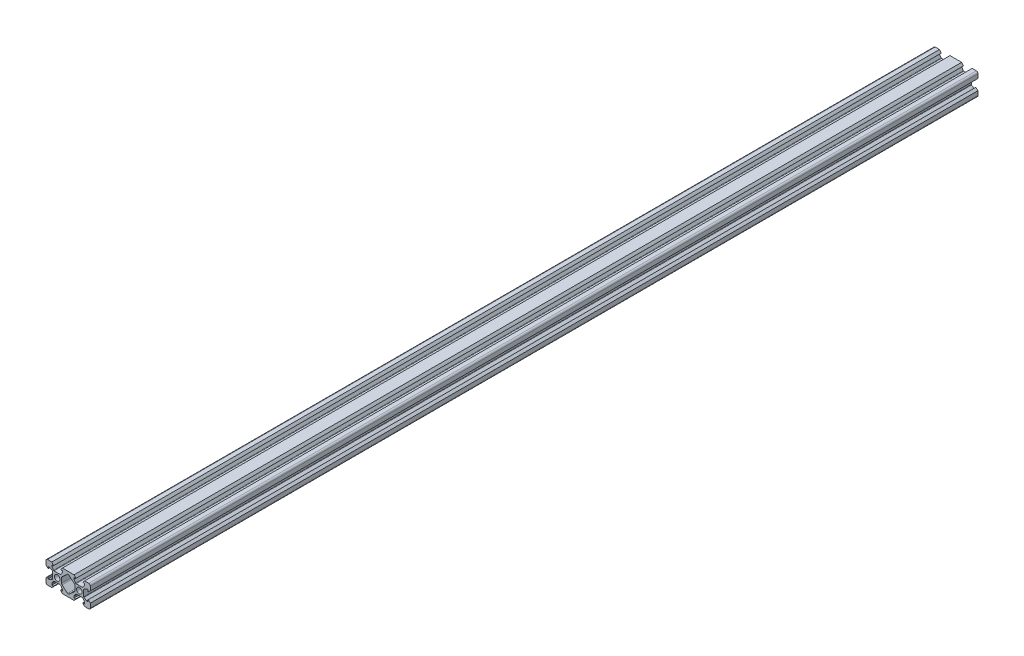
from build123d import *

# Parameters (mm, degrees)
SKETCH_1_R      = 2.5
EXTRUDE_1_DEPTH = 800


with BuildPart() as part:
    # Эскиз1 → Бобышка-Вытянуть1 (new body)
    with BuildSketch(Plane.XY):
        with BuildLine():
            Line((-18.5, 14.076873633), (-14.75, 14.076873633))
            Line((-14.75, 14.076873633), (-13.1, 12.076873633))
            Line((-13.1, 12.076873633), (-14.65, 12.076873633))
            ThreePointArc((-14.65, 12.076873633), (-14.720710678, 12.047584311), (-14.75, 11.976873633))
            Line((-14.75, 11.976873633), (-14.75, 10.726998833))
            ThreePointArc((-14.75, 10.726998833), (-14.728880127, 10.583214884), (-14.667304703, 10.451577729))
            Line((-14.667304703, 10.451577729), (-13.248222071, 8.301452529))
            ThreePointArc((-13.248222071, 8.301452529), (-13.067866147, 8.136583642), (-12.830917368, 8.076873633))
            Line((-12.830917368, 8.076873633), (-7.169082632, 8.076873633))
            ThreePointArc((-7.169082632, 8.076873633), (-6.932133853, 8.136583642), (-6.751777929, 8.301452529))
            Line((-6.751777929, 8.301452529), (-5.332695297, 10.451577729))
            ThreePointArc((-5.332695297, 10.451577729), (-5.271119873, 10.583214884), (-5.25, 10.726998833))
            Line((-5.25, 10.726998833), (-5.25, 11.976873633))
            ThreePointArc((-5.25, 11.976873633), (-5.279289322, 12.047584311), (-5.35, 12.076873633))
            Line((-5.35, 12.076873633), (-6.9, 12.076873633))
            Line((-6.9, 12.076873633), (-5.25, 14.076873633))
            Line((-5.25, 14.076873633), (5.25, 14.076873633))
            Line((5.25, 14.076873633), (6.9, 12.076873633))
            Line((6.9, 12.076873633), (5.35, 12.076873633))
            ThreePointArc((5.35, 12.076873633), (5.279289322, 12.047584311), (5.25, 11.976873633))
            Line((5.25, 11.976873633), (5.25, 10.726998833))
            ThreePointArc((5.25, 10.726998833), (5.271119873, 10.583214884), (5.332695297, 10.451577729))
            Line((5.332695297, 10.451577729), (6.751777929, 8.301452529))
            ThreePointArc((6.751777929, 8.301452529), (6.932133853, 8.136583642), (7.169082632, 8.076873633))
            Line((7.169082632, 8.076873633), (12.830917368, 8.076873633))
            ThreePointArc((12.830917368, 8.076873633), (13.067866147, 8.136583642), (13.248222071, 8.301452529))
            Line((13.248222071, 8.301452529), (14.667304703, 10.451577729))
            ThreePointArc((14.667304703, 10.451577729), (14.728880127, 10.583214884), (14.75, 10.726998833))
            Line((14.75, 10.726998833), (14.75, 11.976873633))
            ThreePointArc((14.75, 11.976873633), (14.720710678, 12.047584311), (14.65, 12.076873633))
            Line((14.65, 12.076873633), (13.1, 12.076873633))
            Line((13.1, 12.076873633), (14.75, 14.076873633))
            Line((14.75, 14.076873633), (18.5, 14.076873633))
            ThreePointArc((18.5, 14.076873633), (19.560660172, 13.637533805), (20, 12.576873633))
            Line((20, 12.576873633), (20, 8.826873633))
            Line((20, 8.826873633), (18, 7.176873633))
            Line((18, 7.176873633), (18, 8.726873633))
            ThreePointArc((18, 8.726873633), (17.970710678, 8.797584311), (17.9, 8.826873633))
            Line((17.9, 8.826873633), (16.6501252, 8.826873633))
            ThreePointArc((16.6501252, 8.826873633), (16.50634125, 8.80575376), (16.374704096, 8.744178337))
            Line((16.374704096, 8.744178337), (14.224578896, 7.325095704))
            ThreePointArc((14.224578896, 7.325095704), (14.059710009, 7.14473978), (14, 6.907791001))
            Line((14, 6.907791001), (14, 1.245956265))
            ThreePointArc((14, 1.245956265), (14.059710009, 1.009007486), (14.224578896, 0.828651562))
            Line((14.224578896, 0.828651562), (16.374704096, -0.59043107))
            ThreePointArc((16.374704096, -0.59043107), (16.50634125, -0.652006494), (16.6501252, -0.673126367))
            Line((16.6501252, -0.673126367), (17.9, -0.673126367))
            ThreePointArc((17.9, -0.673126367), (17.970710678, -0.643837045), (18, -0.573126367))
            Line((18, -0.573126367), (18, 0.976873633))
            Line((18, 0.976873633), (20, -0.673126367))
            Line((20, -0.673126367), (20, -4.423126367))
            ThreePointArc((20, -4.423126367), (19.560660172, -5.483786539), (18.5, -5.923126367))
            Line((18.5, -5.923126367), (14.75, -5.923126367))
            Line((14.75, -5.923126367), (13.1, -3.923126367))
            Line((13.1, -3.923126367), (14.65, -3.923126367))
            ThreePointArc((14.65, -3.923126367), (14.720710678, -3.893837045), (14.75, -3.823126367))
            Line((14.75, -3.823126367), (14.75, -2.573251567))
            ThreePointArc((14.75, -2.573251567), (14.728880127, -2.429467617), (14.667304703, -2.297830463))
            Line((14.667304703, -2.297830463), (13.248222071, -0.147705263))
            ThreePointArc((13.248222071, -0.147705263), (13.067866147, 0.017163624), (12.830917368, 0.076873633))
            Line((12.830917368, 0.076873633), (7.169082632, 0.076873633))
            ThreePointArc((7.169082632, 0.076873633), (6.932133853, 0.017163624), (6.751777929, -0.147705263))
            Line((6.751777929, -0.147705263), (5.332695297, -2.297830463))
            ThreePointArc((5.332695297, -2.297830463), (5.271119873, -2.429467617), (5.25, -2.573251567))
            Line((5.25, -2.573251567), (5.25, -3.823126367))
            ThreePointArc((5.25, -3.823126367), (5.279289322, -3.893837045), (5.35, -3.923126367))
            Line((5.35, -3.923126367), (6.9, -3.923126367))
            Line((6.9, -3.923126367), (5.25, -5.923126367))
            Line((5.25, -5.923126367), (-5.25, -5.923126367))
            Line((-5.25, -5.923126367), (-6.9, -3.923126367))
            Line((-6.9, -3.923126367), (-5.35, -3.923126367))
            ThreePointArc((-5.35, -3.923126367), (-5.279289322, -3.893837045), (-5.25, -3.823126367))
            Line((-5.25, -3.823126367), (-5.25, -2.573251567))
            ThreePointArc((-5.25, -2.573251567), (-5.271119873, -2.429467617), (-5.332695297, -2.297830463))
            Line((-5.332695297, -2.297830463), (-6.751777929, -0.147705263))
            ThreePointArc((-6.751777929, -0.147705263), (-6.932133853, 0.017163624), (-7.169082632, 0.076873633))
            Line((-7.169082632, 0.076873633), (-12.830917368, 0.076873633))
            ThreePointArc((-12.830917368, 0.076873633), (-13.067866147, 0.017163624), (-13.248222071, -0.147705263))
            Line((-13.248222071, -0.147705263), (-14.667304703, -2.297830463))
            ThreePointArc((-14.667304703, -2.297830463), (-14.728880127, -2.429467617), (-14.75, -2.573251567))
            Line((-14.75, -2.573251567), (-14.75, -3.823126367))
            ThreePointArc((-14.75, -3.823126367), (-14.720710678, -3.893837045), (-14.65, -3.923126367))
            Line((-14.65, -3.923126367), (-13.1, -3.923126367))
            Line((-13.1, -3.923126367), (-14.75, -5.923126367))
            Line((-14.75, -5.923126367), (-18.5, -5.923126367))
            ThreePointArc((-18.5, -5.923126367), (-19.560660172, -5.483786539), (-20, -4.423126367))
            Line((-20, -4.423126367), (-20, -0.673126367))
            Line((-20, -0.673126367), (-18, 0.976873633))
            Line((-18, 0.976873633), (-18, -0.573126367))
            ThreePointArc((-18, -0.573126367), (-17.970710678, -0.643837045), (-17.9, -0.673126367))
            Line((-17.9, -0.673126367), (-16.6501252, -0.673126367))
            ThreePointArc((-16.6501252, -0.673126367), (-16.50634125, -0.652006494), (-16.374704096, -0.59043107))
            Line((-16.374704096, -0.59043107), (-14.224578896, 0.828651562))
            ThreePointArc((-14.224578896, 0.828651562), (-14.059710009, 1.009007486), (-14, 1.245956265))
            Line((-14, 1.245956265), (-14, 6.907791001))
            ThreePointArc((-14, 6.907791001), (-14.059710009, 7.14473978), (-14.224578896, 7.325095704))
            Line((-14.224578896, 7.325095704), (-16.374704096, 8.744178337))
            ThreePointArc((-16.374704096, 8.744178337), (-16.50634125, 8.80575376), (-16.6501252, 8.826873633))
            Line((-16.6501252, 8.826873633), (-17.9, 8.826873633))
            ThreePointArc((-17.9, 8.826873633), (-17.970710678, 8.797584311), (-18, 8.726873633))
            Line((-18, 8.726873633), (-18, 7.176873633))
            Line((-18, 7.176873633), (-20, 8.826873633))
            Line((-20, 8.826873633), (-20, 12.576873633))
            ThreePointArc((-20, 12.576873633), (-19.560660172, 13.637533805), (-18.5, 14.076873633))
        make_face()
        with Locations((-10, 4.076873633)):
            Circle(SKETCH_1_R, mode=Mode.SUBTRACT)
        with Locations((10, 4.076873633)):
            Circle(SKETCH_1_R, mode=Mode.SUBTRACT)
        with BuildLine():
            Line((-6, 6.220171901), (-6, 1.933575365))
            ThreePointArc((-6, 1.933575365), (-5.863556224, 1.30850383), (-5.479047434, 0.797148455))
            Line((-5.479047434, 0.797148455), (-0.652698289, -3.360817802))
            ThreePointArc((-0.652698289, -3.360817802), (0, -3.603199861), (0.652698289, -3.360817802))
            Line((0.652698289, -3.360817802), (5.479047434, 0.797148455))
            ThreePointArc((5.479047434, 0.797148455), (5.863556224, 1.30850383), (6, 1.933575365))
            Line((6, 1.933575365), (6, 6.220171901))
            ThreePointArc((6, 6.220171901), (5.863556224, 6.845243437), (5.479047434, 7.356598811))
            Line((5.479047434, 7.356598811), (0.652698289, 11.514565068))
            ThreePointArc((0.652698289, 11.514565068), (0, 11.756947128), (-0.652698289, 11.514565068))
            Line((-0.652698289, 11.514565068), (-5.479047434, 7.356598811))
            ThreePointArc((-5.479047434, 7.356598811), (-5.863556224, 6.845243437), (-6, 6.220171901))
        make_face(mode=Mode.SUBTRACT)
    extrude(amount=-EXTRUDE_1_DEPTH)


solid = part.part
